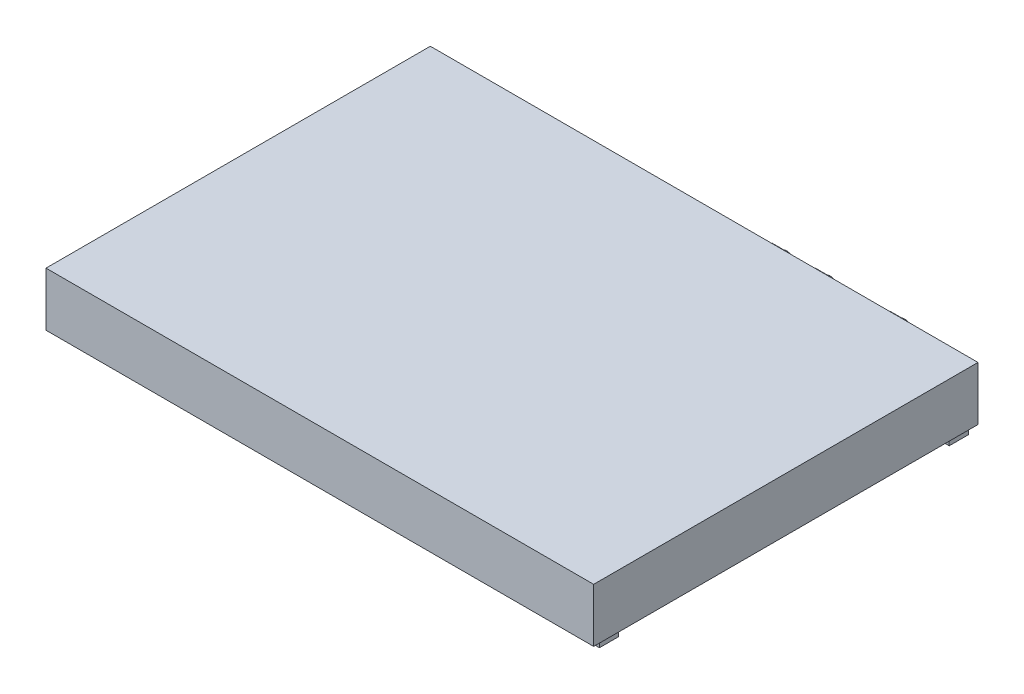
from build123d import *

# Parameters (mm, degrees)
SKIZZE1_W                       = 200
SKIZZE1_H                       = 28
AUFSATZ_LINEAR_AUSTRAGEN1_DEPTH = 142.5
SKIZZE2_W                       = 15
SKIZZE2_H                       = 20.7
AUFSATZ_LINEAR_AUSTRAGEN2_DEPTH = 2
AUFSATZ_LINEAR_AUSTRAGEN3_DEPTH = 5
AUFSATZ_LINEAR_AUSTRAGEN4_DEPTH = 4.7
SKIZZE6_R                       = 4.5
AUFSATZ_LINEAR_AUSTRAGEN5_DEPTH = 3.3
SKIZZE7_R                       = 3.25
SCHNITT_LINEAR_AUSTRAGEN1_DEPTH = 44
SKIZZE8_W                       = 10
SKIZZE8_H                       = 10
AUFSATZ_LINEAR_AUSTRAGEN6_DEPTH = 3.1
SPIEGELN2_COPY_1_SKETCH_W       = 10
SPIEGELN2_COPY_1_SKETCH_H       = 10
SPIEGELN2_COPY_1_DEPTH          = 3.1


with BuildPart() as part:
    # Skizze1 → Aufsatz-Linear austragen1 (new, symmetric)
    with BuildSketch(Plane(origin=(0, 0, 0), x_dir=(0, 0, -1), z_dir=(1, 0, 0))):
        Rectangle(SKIZZE1_W, SKIZZE1_H)
    extrude(amount=AUFSATZ_LINEAR_AUSTRAGEN1_DEPTH, both=True)

    # Skizze2 → Aufsatz-Linear austragen2 (add)
    with BuildSketch(Plane(origin=(0, 0, -100), x_dir=(-1, 0, 0), z_dir=(0, 0, -1))):
        with Locations((130.5, 1.4)):
            Rectangle(SKIZZE2_W, SKIZZE2_H)
    extrude(amount=AUFSATZ_LINEAR_AUSTRAGEN2_DEPTH)

    # Skizze3 → Aufsatz-Linear austragen3 (add, symmetric)
    with BuildSketch(Plane.ZY.offset(130.5)):
        Polygon((-102, 9.25), (-106.5, 6.651923789), (-102, -6.95), align=None)
    extrude(amount=AUFSATZ_LINEAR_AUSTRAGEN3_DEPTH, both=True)

    # Skizze5 → Aufsatz-Linear austragen4 (add)
    with BuildSketch(Plane(origin=(0, 0, -100), x_dir=(-1, 0, 0), z_dir=(0, 0, -1))):
        Polygon((-100.830127019, -5.5), (-92.169872981, -5.5), (-87.839745962, 2), (-92.169872981, 9.5), (-100.830127019, 9.5), (-105.160254038, 2), align=None)
    aufsatz_linear_austragen4 = extrude(amount=AUFSATZ_LINEAR_AUSTRAGEN4_DEPTH)

    # Skizze6 → Aufsatz-Linear austragen5 (add)
    with BuildSketch(Plane(origin=(0, 0, -104.7), x_dir=(-1, 0, 0), z_dir=(0, 0, -1))):
        with Locations((-96.5, 2)):
            Circle(SKIZZE6_R)
    aufsatz_linear_austragen5 = extrude(amount=AUFSATZ_LINEAR_AUSTRAGEN5_DEPTH)

    # Skizze7 → Schnitt-Linear austragen1 (cut)
    with BuildSketch(Plane(origin=(0, 0, -108), x_dir=(-1, 0, 0), z_dir=(0, 0, -1))):
        with Locations((-96.5, 2)):
            Circle(SKIZZE7_R)
    schnitt_linear_austragen1 = extrude(amount=-SCHNITT_LINEAR_AUSTRAGEN1_DEPTH, mode=Mode.SUBTRACT)

    # Skizzen-Muster1: Aufsatz-Linear austragen4, Aufsatz-Linear austragen5, Schnitt-Linear austragen1 at 2 more places
    with Locations((-39, 0, 0), (-61.5, 0, 0)):
        add(aufsatz_linear_austragen4)
        add(aufsatz_linear_austragen5)
        add(schnitt_linear_austragen1, mode=Mode.SUBTRACT)

    # Skizze8 → Aufsatz-Linear austragen6 (add)
    with BuildSketch(Plane.XZ.offset(14)):
        with Locations((136.5, -91)):
            Rectangle(SKIZZE8_W, SKIZZE8_H)
    aufsatz_linear_austragen6 = extrude(amount=AUFSATZ_LINEAR_AUSTRAGEN6_DEPTH)

    # Spiegeln1: Aufsatz-Linear austragen6 across plane
    add(aufsatz_linear_austragen6.mirror(Plane(origin=(0, 0, 0), x_dir=(0, 0, 1), z_dir=(1, 0, 0))))

    # Spiegeln2: Aufsatz-Linear austragen6 across plane
    add(aufsatz_linear_austragen6.mirror(Plane.XY))

    # Spiegeln2 copy 1 sketch → Spiegeln2 copy 1 (add)
    with BuildSketch(Plane(origin=(0, -14, 0), x_dir=(-1, 0, 0), z_dir=(0, -1, 0))):
        with Locations((136.5, -91)):
            Rectangle(SPIEGELN2_COPY_1_SKETCH_W, SPIEGELN2_COPY_1_SKETCH_H)
    extrude(amount=SPIEGELN2_COPY_1_DEPTH)


solid = part.part
